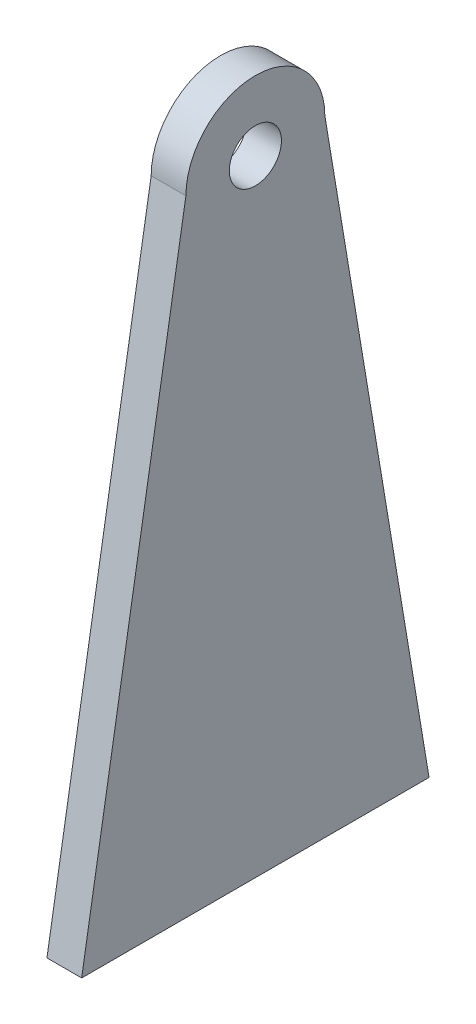
from build123d import *

# Parameters (mm, degrees)
SKETCH2_R           = 7.5
BOSS_EXTRUDE1_DEPTH = 5
CUT_EXTRUDE1_DEPTH  = 4


with BuildPart() as part:
    # Sketch2 → Boss-Extrude1 (new, symmetric)
    with BuildSketch(Plane(origin=(0, 0, 0), x_dir=(0, 0, -1), z_dir=(1, 0, 0))):
        with BuildLine():
            Line((50, 0), (-50, 0))
            Line((-50, 0), (-20, 180))
            ThreePointArc((-20, 180), (0, 200), (20, 180))
            Line((20, 180), (50, 0))
        make_face()
        with Locations((0, 180)):
            Circle(SKETCH2_R, mode=Mode.SUBTRACT)
    extrude(amount=BOSS_EXTRUDE1_DEPTH, both=True)

    # Sketch3 → Cut-Extrude1 (cut)
    with BuildSketch(Plane.ZY.offset(5)):
        Polygon((0, 33), (-35, 33), (-35, 39), (35, 39), (35, 33), align=None)
    extrude(amount=-CUT_EXTRUDE1_DEPTH, mode=Mode.SUBTRACT)


solid = part.part
